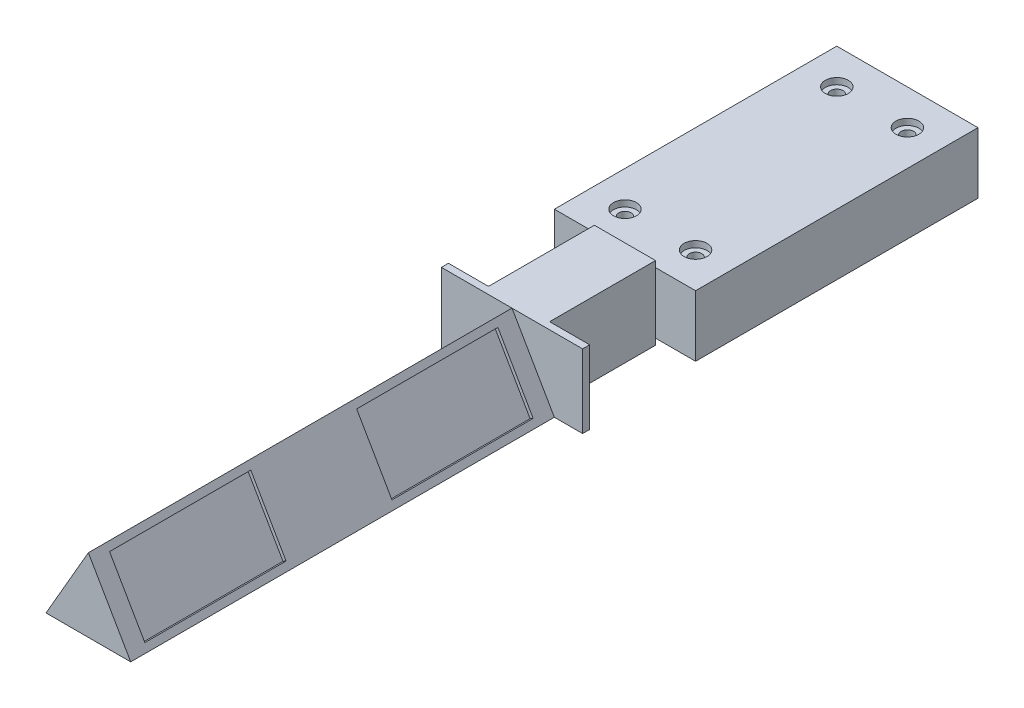
from build123d import *

# Parameters (mm, degrees)
EXTRUDE_2_DEPTH     = 120
SKETCH_3_W          = 40
SKETCH_3_H          = 20.78460969
EXTRUDE_3_DEPTH     = 2
SKETCH_4_W          = 17.320508076
SKETCH_4_H          = 20.78460969
EXTRUDE_4_DEPTH     = 30
SKETCH_5_W          = 40
SKETCH_5_H          = 17.320508076
EXTRUDE_5_DEPTH     = 80
SKETCH_6_R          = 1.75
CUT_EXTRUDE_1_DEPTH = 234.786227139
SKETCH_7_R          = 3.25
CUT_EXTRUDE_2_DEPTH = 3.5
SKETCH_8_W          = 40
SKETCH_8_H          = 20
CUT_EXTRUDE_3_DEPTH = 1
SKETCH_10_W         = 40
SKETCH_10_H         = 20
CUT_EXTRUDE_4_DEPTH = 1
SKETCH_11_W         = 20
SKETCH_11_H         = 40
CUT_EXTRUDE_5_DEPTH = 1


with BuildPart() as part:
    # ｽｹｯﾁ2 → ﾎﾞｽ - 押し出し2 (new body)
    with BuildSketch(Plane(origin=(0, 0, 0), x_dir=(-1, 0, 0), z_dir=(0, 0, -1))):
        Polygon((12, -10.392304845), (0, 10.392304845), (-12, -10.392304845), align=None)
    extrude(amount=EXTRUDE_2_DEPTH)

    # ｽｹｯﾁ3 → ﾎﾞｽ - 押し出し3 (add)
    with BuildSketch(Plane(origin=(0, 0, -120), x_dir=(-1, 0, 0), z_dir=(0, 0, -1))):
        Rectangle(SKETCH_3_W, SKETCH_3_H)
    extrude(amount=EXTRUDE_3_DEPTH)

    # ｽｹｯﾁ4 → ﾎﾞｽ - 押し出し4 (add)
    with BuildSketch(Plane(origin=(0, 0, -122), x_dir=(-1, 0, 0), z_dir=(0, 0, -1))):
        Rectangle(SKETCH_4_W, SKETCH_4_H)
    extrude(amount=EXTRUDE_4_DEPTH)

    # ｽｹｯﾁ5 → ﾎﾞｽ - 押し出し5 (add)
    with BuildSketch(Plane(origin=(0, 0, -152), x_dir=(-1, 0, 0), z_dir=(0, 0, -1))):
        Rectangle(SKETCH_5_W, SKETCH_5_H)
    extrude(amount=EXTRUDE_5_DEPTH)

    # ｽｹｯﾁ6 → ｶｯﾄ - 押し出し1 (cut, through all)
    with BuildSketch(Plane(origin=(0, 10.392304845, 0), x_dir=(1, 0, 0), z_dir=(0, 1, 0))):
        with Locations(Location((-10, 162, 0), (0, 0, 270))):
            Circle(SKETCH_6_R)
        with Locations(Location((10, 162, 0), (0, 0, 270))):
            Circle(SKETCH_6_R)
        with Locations(Location((-10, 222, 0), (0, 0, 270))):
            Circle(SKETCH_6_R)
        with Locations(Location((10, 222, 0), (0, 0, 270))):
            Circle(SKETCH_6_R)
    extrude(amount=-CUT_EXTRUDE_1_DEPTH, mode=Mode.SUBTRACT)

    # ｽｹｯﾁ7 → ｶｯﾄ - 押し出し2 (cut)
    with BuildSketch(Plane(origin=(0, 10.392304845, 0), x_dir=(1, 0, 0), z_dir=(0, 1, 0))):
        with Locations(Location((-10, 162, 0), (0, 0, 270))):
            Circle(SKETCH_7_R)
        with Locations(Location((-10, 222, 0), (0, 0, 270))):
            Circle(SKETCH_7_R)
        with Locations(Location((10, 222, 0), (0, 0, 270))):
            Circle(SKETCH_7_R)
        with Locations(Location((10, 162, 0), (0, 0, 270))):
            Circle(SKETCH_7_R)
    extrude(amount=-CUT_EXTRUDE_2_DEPTH, mode=Mode.SUBTRACT)

    # ｽｹｯﾁ8 → ｶｯﾄ - 押し出し3 (cut)
    with BuildSketch(Plane(origin=(-4.5, 2.598076211, 0), x_dir=(0, 0, 1), z_dir=(-0.8660254037844386, 0.5000000000000001, 0))):
        with Locations((-95, -3)):
            Rectangle(SKETCH_8_W, SKETCH_8_H)
        with Locations((-25, -3)):
            Rectangle(SKETCH_8_W, SKETCH_8_H)
    extrude(amount=-CUT_EXTRUDE_3_DEPTH, mode=Mode.SUBTRACT)

    # ｽｹｯﾁ10 → ｶｯﾄ - 押し出し4 (cut)
    with BuildSketch(Plane(origin=(4.5, 2.598076211, 0), x_dir=(0, 0, -1), z_dir=(0.8660254037844387, 0.5000000000000001, 0))):
        with Locations((25, -3)):
            Rectangle(SKETCH_10_W, SKETCH_10_H)
        with Locations((95, -3)):
            Rectangle(SKETCH_10_W, SKETCH_10_H)
    extrude(amount=-CUT_EXTRUDE_4_DEPTH, mode=Mode.SUBTRACT)

    # ｽｹｯﾁ11 → ｶｯﾄ - 押し出し5 (cut)
    with BuildSketch(Plane(origin=(0, -10.392304845, 0), x_dir=(-1, 0, 0), z_dir=(0, -1, 0))):
        with Locations((0, 25)):
            Rectangle(SKETCH_11_W, SKETCH_11_H)
        with Locations((0, 95)):
            Rectangle(SKETCH_11_W, SKETCH_11_H)
    extrude(amount=-CUT_EXTRUDE_5_DEPTH, mode=Mode.SUBTRACT)


solid = part.part
